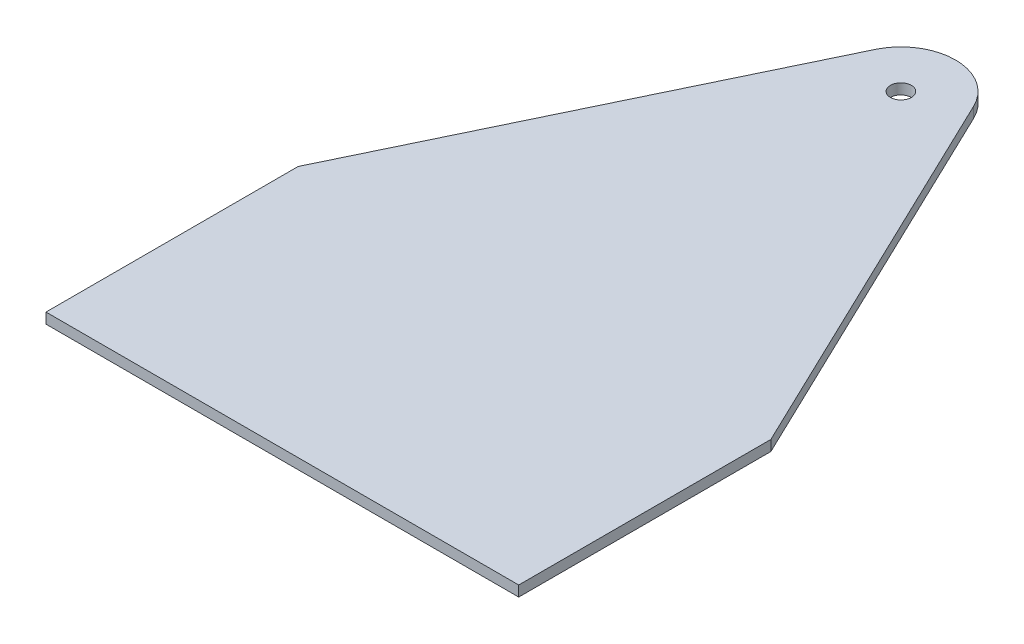
from build123d import *

# Parameters (mm, degrees)
SKETCH1_R           = 3.175
BOSS_EXTRUDE1_DEPTH = 3.175


with BuildPart() as part:
    # Sketch1 → Boss-Extrude1 (new body)
    with BuildSketch(Plane(origin=(0, 0, 0), x_dir=(1, 0, 0), z_dir=(0, 1, 0))):
        with BuildLine():
            Line((-71.4375, 0), (71.4375, 0))
            Line((71.4375, 0), (71.4375, 76.2))
            Line((71.4375, 76.2), (14.862434405, 194.077710585))
            ThreePointArc((14.862434405, 194.077710585), (0, 203.430105186), (-14.862434405, 194.077710585))
            Line((-14.862434405, 194.077710585), (-71.4375, 76.2))
            Line((-71.4375, 76.2), (-71.4375, 0))
        make_face()
        with Locations(Location((0, 186.944528263, 0), (0, 0, 270))):
            Circle(SKETCH1_R, mode=Mode.SUBTRACT)
    extrude(amount=BOSS_EXTRUDE1_DEPTH)


solid = part.part
